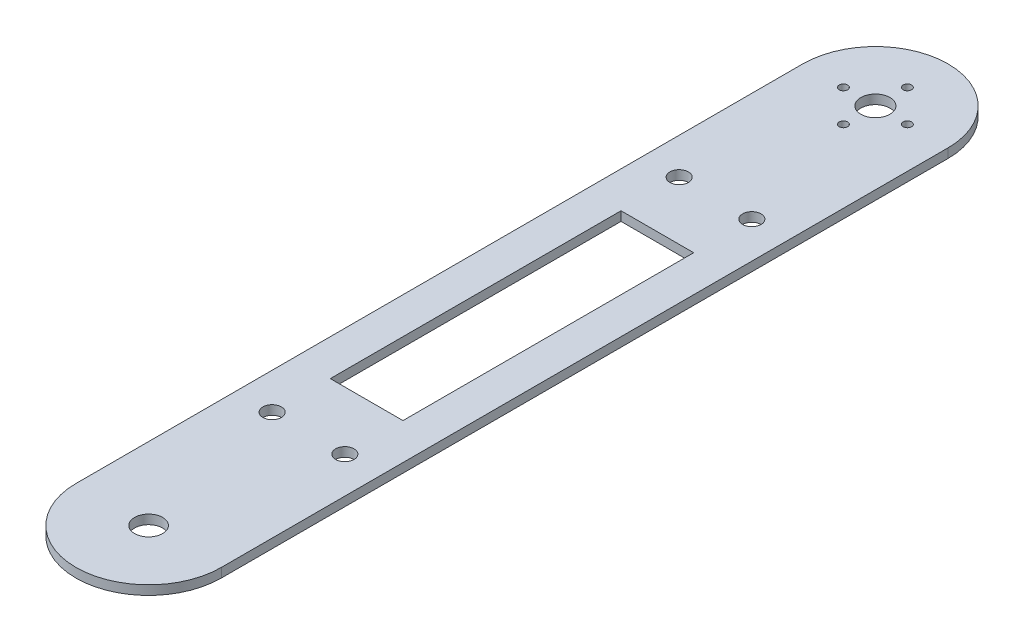
from build123d import *

# Parameters (mm, degrees)
SKETCH1_W              = 50
SKETCH1_H              = 300
BOSS_EXTRUDE1_DEPTH    = 3.175
CUT_EXTRUDE1_DEPTH     = 6.35
SKETCH3_R              = 5
SKETCH3_R_2            = 4.82
SKETCH3_R_3            = 1.025
CUT_EXTRUDE2_DEPTH     = 6.35
SKETCH4_R              = 3.175
SKETCH4_W              = 25
SKETCH4_H              = 100
CUT_EXTRUDE3_DEPTH     = 6.35
M2_5_CLEARANCE_HOLE1_D = 2.9


with BuildPart() as part:
    # Sketch1 → Boss-Extrude1 (new body)
    with BuildSketch(Plane(origin=(0, 0, 0), x_dir=(1, 0, 0), z_dir=(0, 1, 0))):
        with Locations((25, -150)):
            Rectangle(SKETCH1_W, SKETCH1_H)
    extrude(amount=BOSS_EXTRUDE1_DEPTH)

    # Sketch2 → Cut-Extrude1 (cut)
    with BuildSketch(Plane(origin=(0, 3.175, 0), x_dir=(1, 0, 0), z_dir=(0, 1, 0))):
        with BuildLine():
            ThreePointArc((25, 0), (42.67766953, -7.32233047), (50, -25))
            Line((50, -25), (50, 0))
            Line((50, 0), (25, 0))
        make_face()
        with BuildLine():
            Line((0, 0), (0, -25))
            ThreePointArc((0, -25), (7.32233047, -7.32233047), (25, 0))
            Line((25, 0), (0, 0))
        make_face()
        with BuildLine():
            Line((50, -300), (50, -275))
            ThreePointArc((50, -275), (42.67766953, -292.67766953), (25, -300))
            Line((25, -300), (50, -300))
        make_face()
        with BuildLine():
            ThreePointArc((25, -300), (7.32233047, -292.67766953), (0, -275))
            Line((0, -275), (0, -300))
            Line((0, -300), (25, -300))
        make_face()
    extrude(amount=-CUT_EXTRUDE1_DEPTH, mode=Mode.SUBTRACT)

    # Sketch3 → Cut-Extrude2 (cut)
    with BuildSketch(Plane(origin=(0, 3.175, 0), x_dir=(1, 0, 0), z_dir=(0, 1, 0))):
        with Locations(Location((25, -25, 0), (0, 0, 270))):
            Circle(SKETCH3_R)
        with Locations(Location((25, -275, 0), (0, 0, 270))):
            Circle(SKETCH3_R_2)
        with Locations(Location((25, -14, 0), (0, 0, 270))):
            Circle(SKETCH3_R_3)
        with Locations(Location((14, -25, 0), (0, 0, 270))):
            Circle(SKETCH3_R_3)
        with Locations(Location((25, -36, 0), (0, 0, 270))):
            Circle(SKETCH3_R_3)
        with Locations(Location((36, -25, 0), (0, 0, 270))):
            Circle(SKETCH3_R_3)
    extrude(amount=-CUT_EXTRUDE2_DEPTH, mode=Mode.SUBTRACT)

    # Sketch4 → Cut-Extrude3 (cut)
    with BuildSketch(Plane(origin=(0, 3.175, 0), x_dir=(1, 0, 0), z_dir=(0, 1, 0))):
        with Locations(Location((12.5, -80, 0), (0, 0, 270))):
            Circle(SKETCH4_R)
        with Locations(Location((12.5, -220, 0), (0, 0, 270))):
            Circle(SKETCH4_R)
        with Locations(Location((37.5, -220, 0), (0, 0, 270))):
            Circle(SKETCH4_R)
        with Locations(Location((37.5, -80, 0), (0, 0, 270))):
            Circle(SKETCH4_R)
        with Locations((25, -150)):
            Rectangle(SKETCH4_W, SKETCH4_H)
    extrude(amount=-CUT_EXTRUDE3_DEPTH, mode=Mode.SUBTRACT)

    # M2.5 Clearance Hole1 (through all)
    with Locations(Plane(origin=(0, 3.175, 0), x_dir=(1, 0, 0), z_dir=(0, 1, 0))):
        with Locations((14, -25), (25, -14), (36, -25), (25, -36)):
            Hole(M2_5_CLEARANCE_HOLE1_D / 2)


solid = part.part
